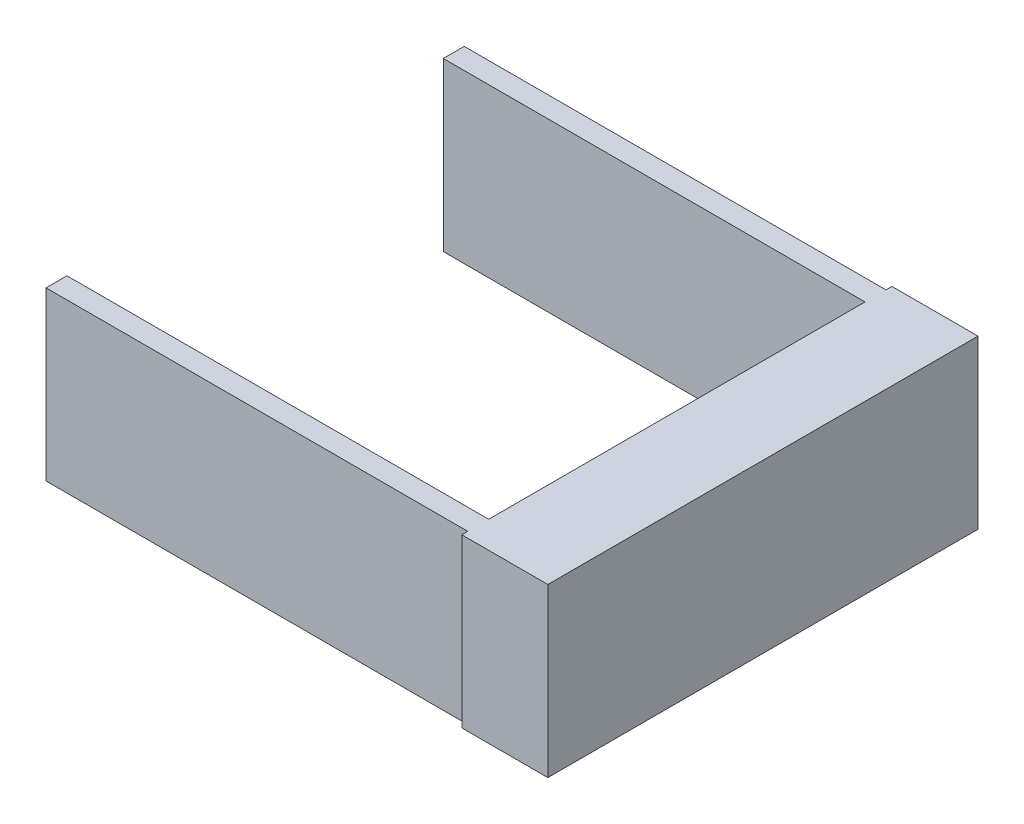
from build123d import *

# Parameters (mm, degrees)
BOSS_EXTRUDE1_DEPTH = 28


with BuildPart() as part:
    # Sketch1 → Boss-Extrude1 (new body)
    with BuildSketch(Plane(origin=(0, 0, 0), x_dir=(1, 0, 0), z_dir=(0, 1, 0))):
        Polygon((-50, -35), (20.59450896, -35), (20.59450896, -36), (35, -36), (35, 36), (20.59450896, 36), (20.59450896, 35), (-50, 35), (-50, 31.5), (20.59450896, 31.5), (20.59450896, -31.5), (-50, -31.5), align=None)
    extrude(amount=BOSS_EXTRUDE1_DEPTH)


solid = part.part
